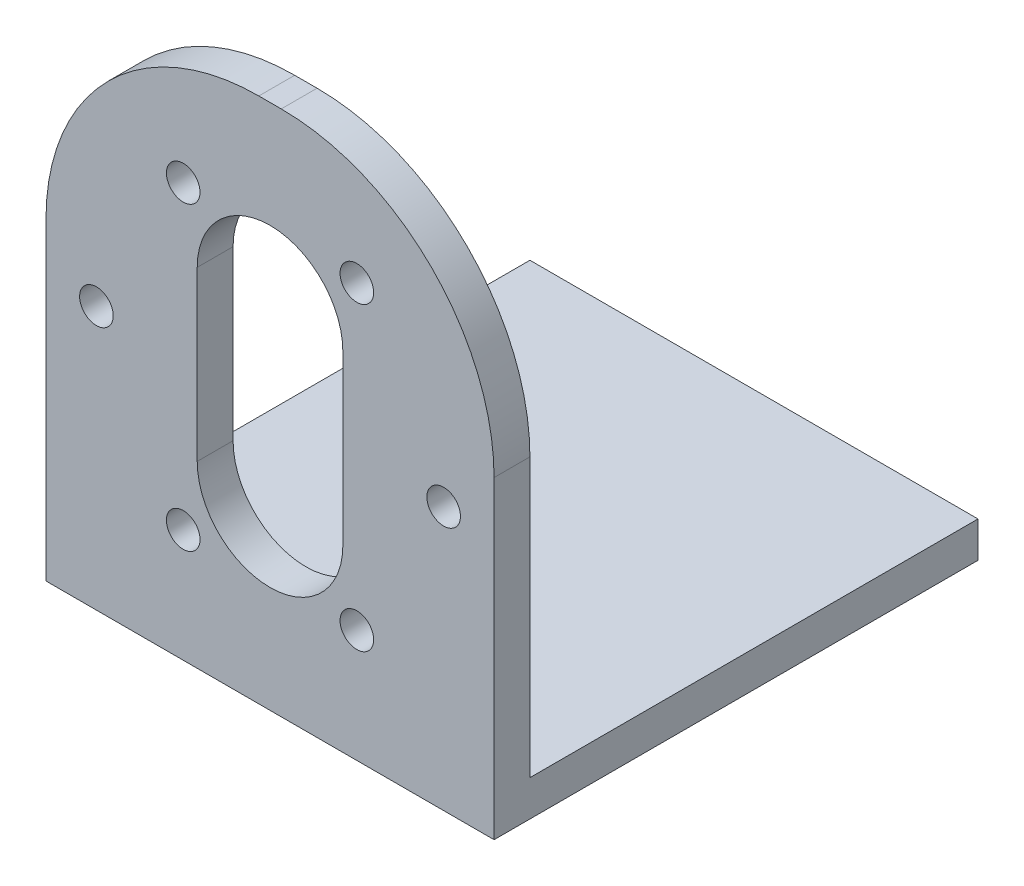
from build123d import *

# Parameters (mm, degrees)
CROQUIS1_R              = 1.5
SALIENTE_EXTRUIR1_DEPTH = 1.6
CROQUIS2_W              = 40
CROQUIS2_H              = 3.2
SALIENTE_EXTRUIR2_DEPTH = 40


with BuildPart() as part:
    # Croquis1 → Saliente-Extruir1 (new, symmetric)
    with BuildSketch(Plane.XY):
        with BuildLine():
            Line((-20, -23.5), (20, -23.5))
            Line((20, -23.5), (20, 4.5))
            ThreePointArc((20, 4.5), (14.435028843, 17.935028843), (1, 23.5))
            Line((1, 23.5), (-1, 23.5))
            ThreePointArc((-1, 23.5), (-14.435028843, 17.935028843), (-20, 4.5))
            Line((-20, 4.5), (-20, -23.5))
        make_face()
        with Locations((-15.5, 0)):
            Circle(CROQUIS1_R, mode=Mode.SUBTRACT)
        with Locations((-7.75, 13.423393759)):
            Circle(CROQUIS1_R, mode=Mode.SUBTRACT)
        with Locations((7.75, 13.423393759)):
            Circle(CROQUIS1_R, mode=Mode.SUBTRACT)
        with Locations((15.5, 0)):
            Circle(CROQUIS1_R, mode=Mode.SUBTRACT)
        with Locations((7.75, -13.423393759)):
            Circle(CROQUIS1_R, mode=Mode.SUBTRACT)
        with Locations((-7.75, -13.423393759)):
            Circle(CROQUIS1_R, mode=Mode.SUBTRACT)
        with BuildLine():
            Line((6.5, 7.5), (6.5, -7.5))
            ThreePointArc((6.5, -7.5), (0, -14), (-6.5, -7.5))
            Line((-6.5, -7.5), (-6.5, 7.5))
            ThreePointArc((-6.5, 7.5), (0, 14), (6.5, 7.5))
        make_face(mode=Mode.SUBTRACT)
    extrude(amount=SALIENTE_EXTRUIR1_DEPTH, both=True)

    # Croquis2 → Saliente-Extruir2 (add)
    with BuildSketch(Plane(origin=(0, 0, -1.6), x_dir=(-1, 0, 0), z_dir=(0, 0, -1))):
        with Locations((0, -21.9)):
            Rectangle(CROQUIS2_W, CROQUIS2_H)
    extrude(amount=SALIENTE_EXTRUIR2_DEPTH)


solid = part.part
